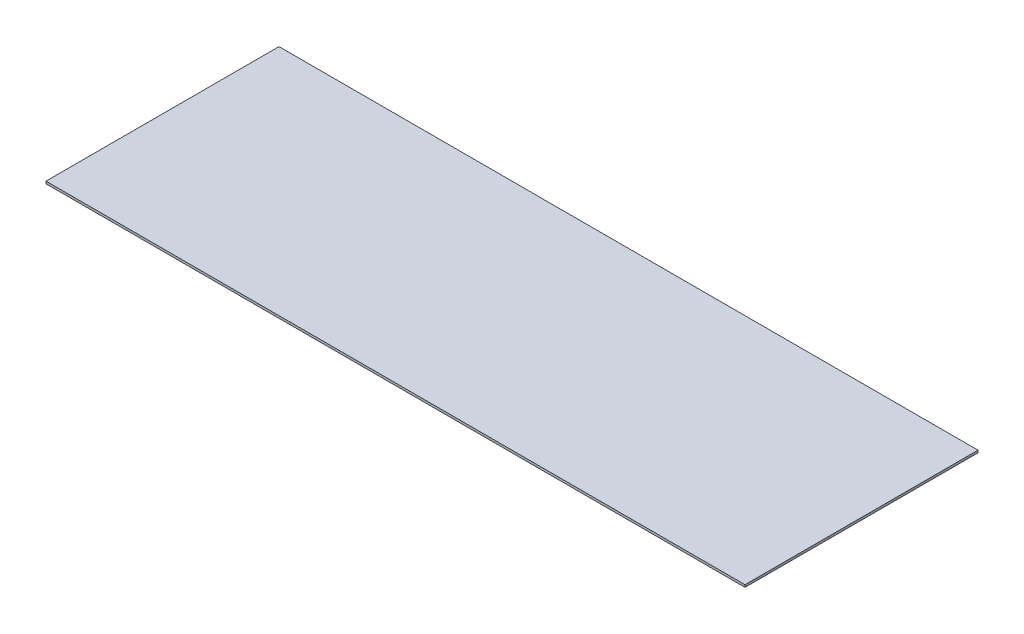
from build123d import *

# Parameters (mm, degrees)
SKETCH1_W           = 300
SKETCH1_H           = 100
BOSS_EXTRUDE4_DEPTH = 1


with BuildPart() as part:
    # Sketch1 → Boss-Extrude4 (new body)
    with BuildSketch(Plane(origin=(0, 0, 0), x_dir=(1, 0, 0), z_dir=(0, 1, 0))):
        Rectangle(SKETCH1_W, SKETCH1_H)
    extrude(amount=BOSS_EXTRUDE4_DEPTH)


solid = part.part
